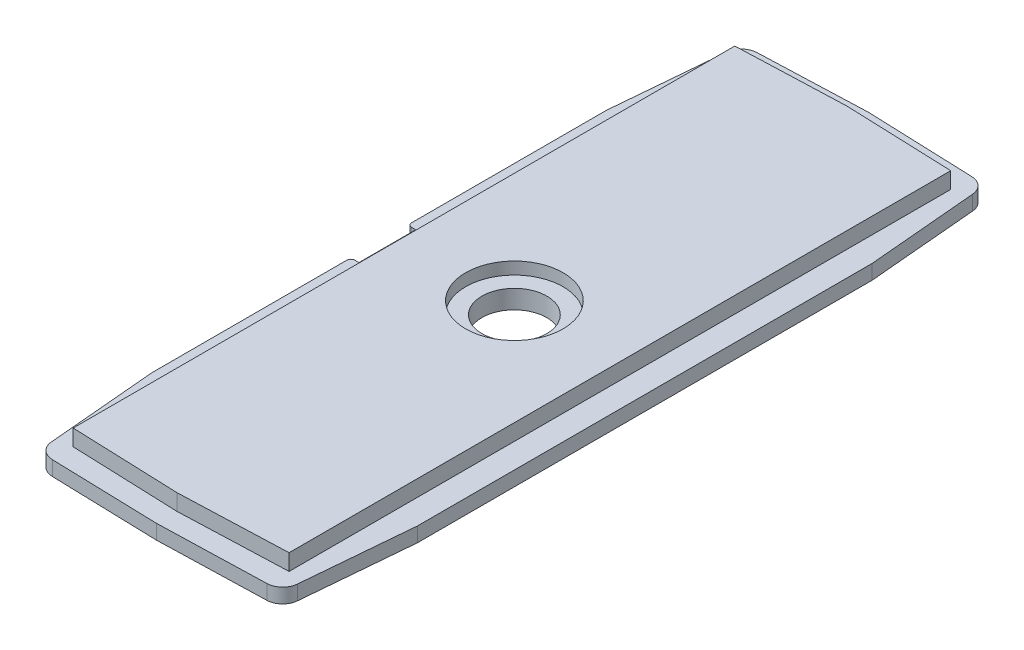
from build123d import *

# Parameters (mm, degrees)
EXTRUDE_1_DEPTH     = 1.8
EXTRUDE_2_DEPTH     = 3.8
FILLET_1_R          = 2
SKETCH_5_R          = 4
CUT_EXTRUDE_1_DEPTH = 4
SKETCH_6_R          = 6
CUT_EXTRUDE_2_DEPTH = 1.5


with BuildPart() as part:
    # Эскиз1 → Бобышка-Вытянуть1 (new body)
    with BuildSketch(Plane(origin=(0, 0, 0), x_dir=(1, 0, 0), z_dir=(0, 1, 0))):
        with BuildLine():
            Line((-15, 43.349382745), (-16.35, 28))
            Line((-16.35, 28), (-16.35, 4))
            ThreePointArc((-16.35, 4), (-16.203553391, 3.646446609), (-15.85, 3.5))
            Line((-15.85, 3.5), (-15.35, 3.5))
            Line((-15.35, 3.5), (-15.35, -3.5))
            Line((-15.35, -3.5), (-15.85, -3.5))
            ThreePointArc((-15.85, -3.5), (-16.203553391, -3.646446609), (-16.35, -4))
            Line((-16.35, -4), (-16.35, -28))
            Line((-16.35, -28), (-15, -43.35061617))
            Line((-15, -43.35061617), (0, -43.784698928))
            Line((0, -43.784698928), (15, -43.35061617))
            Line((15, -43.35061617), (16.35, -28))
            Line((16.35, -28), (16.35, 28))
            Line((16.35, 28), (15, 43.349382745))
            Line((15, 43.349382745), (0, 43.915301072))
            Line((0, 43.915301072), (-15, 43.349382745))
        make_face()
    extrude(amount=EXTRUDE_1_DEPTH)

    # Эскиз4 → Бобышка-Вытянуть2 (add)
    with BuildSketch(Plane(origin=(0, 0, 0), x_dir=(1, 0, 0), z_dir=(0, 1, 0))):
        Polygon((-13.3, 40.75), (-13.3, -40.75), (0, -41.25), (13.3, -40.75), (13.3, 40.75), (0, 41.25), align=None)
    extrude(amount=EXTRUDE_2_DEPTH)

    # Скругление1
    fillet_1_edges = [part.edges().sort_by_distance(p)[0] for p in [
        (-15, 0.9, -43.349382745),
        (15, 0.9, -43.349382745),
        (15, 0.9, 43.35061617),
        (-15, 0.9, 43.35061617),
    ]]
    fillet(fillet_1_edges, radius=FILLET_1_R)

    # Эскиз5 → Вырез-Вытянуть1 (cut)
    with BuildSketch(Plane(origin=(0, 3.8, 0), x_dir=(-1, 0, 0), z_dir=(0, 1, 0))):
        with Locations(Location((-0.3, 0, 0), (0, 0, 90))):
            Circle(SKETCH_5_R)
    extrude(amount=-CUT_EXTRUDE_1_DEPTH, mode=Mode.SUBTRACT)

    # Эскиз6 → Вырез-Вытянуть2 (cut)
    with BuildSketch(Plane(origin=(0, 3.8, 0), x_dir=(1, 0, 0), z_dir=(0, 1, 0))):
        with Locations(Location((0.3, 0, 0), (0, 0, 270))):
            Circle(SKETCH_6_R)
    extrude(amount=-CUT_EXTRUDE_2_DEPTH, mode=Mode.SUBTRACT)


solid = part.part
